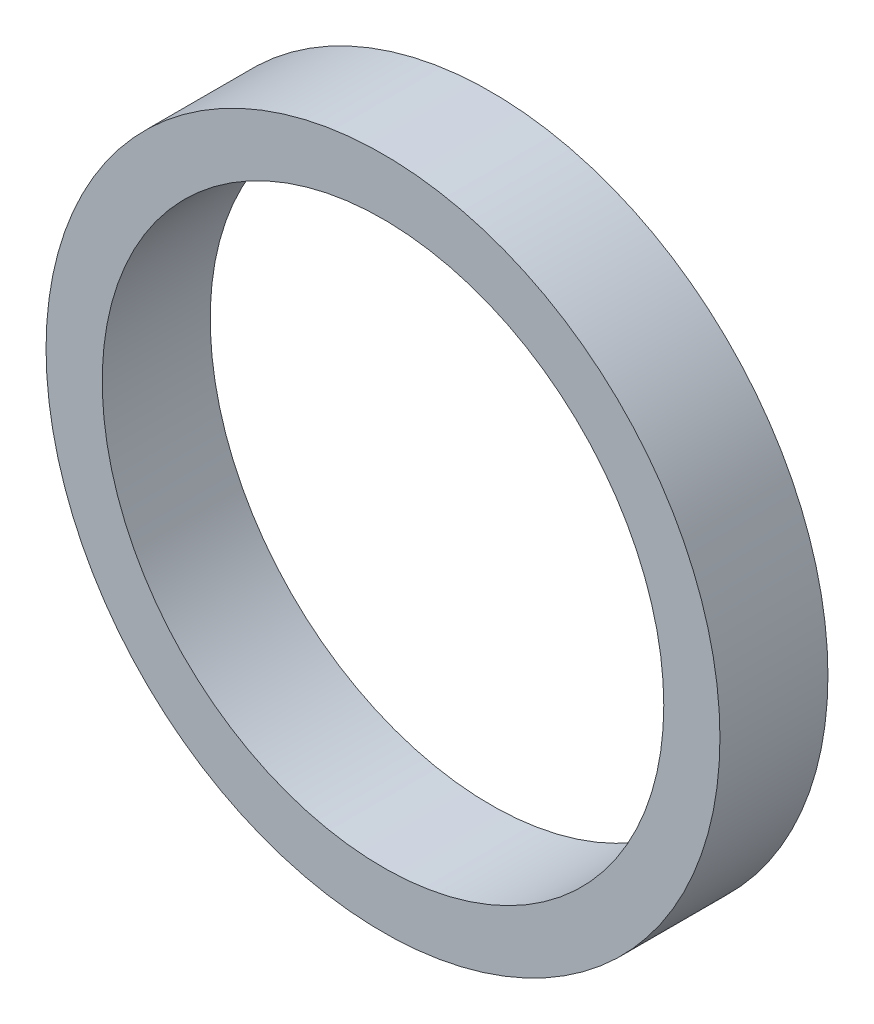
from build123d import *

# Parameters (mm, degrees)
CROQUIS1_R              = 15.6
CROQUIS1_R_2            = 13
SALIENTE_EXTRUIR1_DEPTH = 5


with BuildPart() as part:
    # Croquis1 → Saliente-Extruir1 (new body)
    with BuildSketch(Plane.XY):
        Circle(CROQUIS1_R)
        Circle(CROQUIS1_R_2, mode=Mode.SUBTRACT)
    extrude(amount=SALIENTE_EXTRUIR1_DEPTH)


solid = part.part
